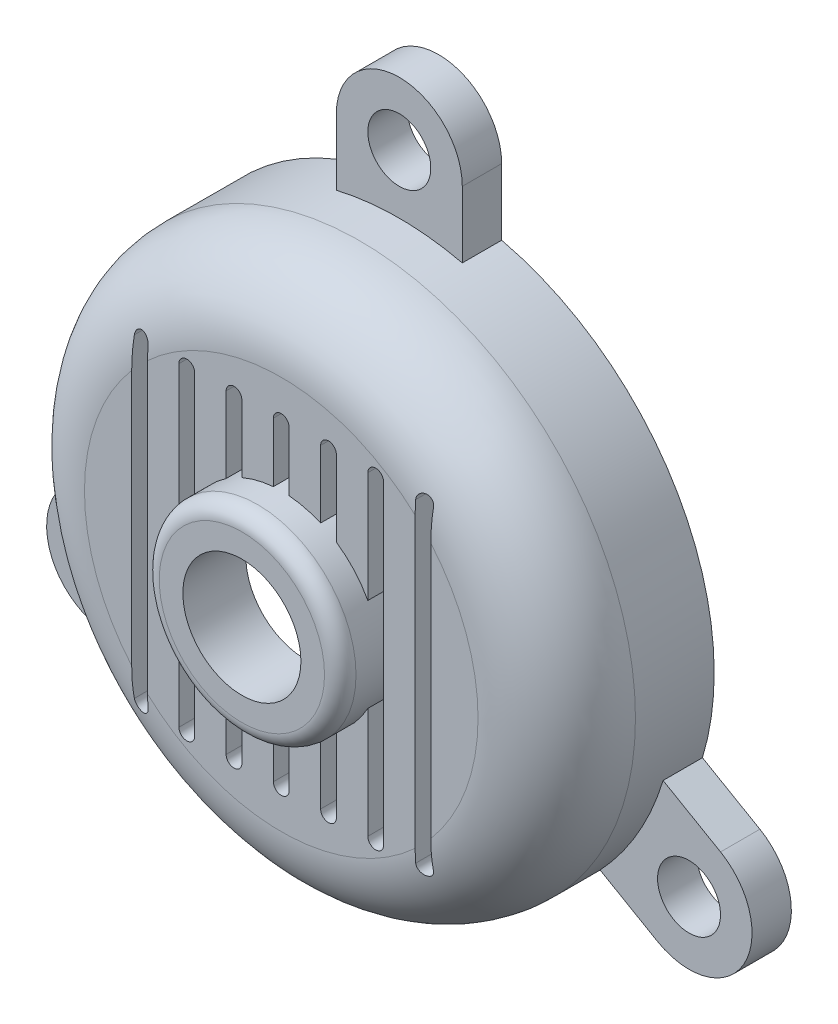
from build123d import *

# Parameters (mm, degrees)
SKETCH1_R           = 350
BOSS_EXTRUDE1_DEPTH = 200
SHELL4_T            = -30
BOSS_EXTRUDE2_START = -50
SKETCH2_R           = 40
BOSS_EXTRUDE2_DEPTH = 50
CIRPATTERN1_COUNT   = 3
FILLET1_R           = 100
CUT_EXTRUDE2_DEPTH  = 50
BOSS_EXTRUDE3_START = -30
SKETCH3_R           = 125
SKETCH3_R_2         = 75
BOSS_EXTRUDE3_DEPTH = 80
FILLET2_R           = 20
CUT_EXTRUDE1_START  = -50
SKETCH4_R           = 75
CUT_EXTRUDE1_DEPTH  = 50


with BuildPart() as part:
    # Sketch1 → Boss-Extrude1 (new body)
    with BuildSketch(Plane.XY):
        Circle(SKETCH1_R)
    extrude(amount=-BOSS_EXTRUDE1_DEPTH)

    # Shell4
    shell4_openings = [part.faces().sort_by_distance(p)[0] for p in [
        (0, 0, -200),
    ]]
    offset(amount=SHELL4_T, openings=shell4_openings, kind=Kind.INTERSECTION)

    # Sketch2 → Boss-Extrude2 (add)
    with BuildSketch(Plane(origin=(0, 0, -200), x_dir=(-1, 0, 0), z_dir=(0, 0, -1)).offset(BOSS_EXTRUDE2_START)):
        with BuildLine():
            ThreePointArc((80, 425), (0, 505), (-80, 425))
            Line((-80, 425), (-80, 340.734500748))
            ThreePointArc((-80, 340.734500748), (0, 350), (80, 340.734500748))
            Line((80, 340.734500748), (80, 425))
        make_face()
        with Locations((0, 425)):
            Circle(SKETCH2_R, mode=Mode.SUBTRACT)
    boss_extrude2 = extrude(amount=BOSS_EXTRUDE2_DEPTH)

    # CirPattern1: Boss-Extrude2 ×3 about axis
    cirpattern1_axis = Axis((0, 0, 0), (0, 0, 1))
    for i in range(1, CIRPATTERN1_COUNT):
        add(boss_extrude2.rotate(cirpattern1_axis, i * 360 / CIRPATTERN1_COUNT))

    # Fillet1
    fillet1_edges = [part.edges().sort_by_distance(p)[0] for p in [
        (-350, 0, 0),
    ]]
    fillet(fillet1_edges, radius=FILLET1_R)

    # Sketch5 → Cut-Extrude2 (cut)
    with BuildSketch(Plane.XY):
        with BuildLine():
            Line((-10, -200), (-10, 200))
            ThreePointArc((-10, 200), (0, 210), (10, 200))
            Line((10, 200), (10, -200))
            ThreePointArc((10, -200), (0, -210), (-10, -200))
        make_face()
        with BuildLine():
            Line((50, -200), (50, 200))
            ThreePointArc((50, 200), (60, 210), (70, 200))
            Line((70, 200), (70, -200))
            ThreePointArc((70, -200), (60, -210), (50, -200))
        make_face()
        with BuildLine():
            Line((110, -200), (110, 200))
            ThreePointArc((110, 200), (120, 210), (130, 200))
            Line((130, 200), (130, -200))
            ThreePointArc((130, -200), (120, -210), (110, -200))
        make_face()
        with BuildLine():
            Line((170, -200), (170, 200))
            ThreePointArc((170, 200), (180, 210), (190, 200))
            Line((190, 200), (190, -200))
            ThreePointArc((190, -200), (180, -210), (170, -200))
        make_face()
        with BuildLine():
            Line((-70, -200), (-70, 200))
            ThreePointArc((-70, 200), (-60, 210), (-50, 200))
            Line((-50, 200), (-50, -200))
            ThreePointArc((-50, -200), (-60, -210), (-70, -200))
        make_face()
        with BuildLine():
            Line((-130, -200), (-130, 200))
            ThreePointArc((-130, 200), (-120, 210), (-110, 200))
            Line((-110, 200), (-110, -200))
            ThreePointArc((-110, -200), (-120, -210), (-130, -200))
        make_face()
        with BuildLine():
            Line((-190, -200), (-190, 200))
            ThreePointArc((-190, 200), (-180, 210), (-170, 200))
            Line((-170, 200), (-170, -200))
            ThreePointArc((-170, -200), (-180, -210), (-190, -200))
        make_face()
    extrude(amount=-CUT_EXTRUDE2_DEPTH, mode=Mode.SUBTRACT)

    # Sketch3 → Boss-Extrude3 (add)
    with BuildSketch(Plane.XY.offset(BOSS_EXTRUDE3_START)):
        with Locations(Location((0, 0, 0), (0, 0, 151.642363424))):
            Circle(SKETCH3_R)
        with Locations(Location((0, 0, 0), (0, 0, 158.960530219))):
            Circle(SKETCH3_R_2, mode=Mode.SUBTRACT)
    extrude(amount=BOSS_EXTRUDE3_DEPTH)

    # Fillet2
    fillet2_edges = [part.edges().sort_by_distance(p)[0] for p in [
        (110, -59.371710435, 50),
    ]]
    fillet(fillet2_edges, radius=FILLET2_R)

    # Sketch4 → Cut-Extrude1 (cut)
    with BuildSketch(Plane.XY.offset(CUT_EXTRUDE1_START)):
        Circle(SKETCH4_R)
    extrude(amount=CUT_EXTRUDE1_DEPTH, mode=Mode.SUBTRACT)


solid = part.part
